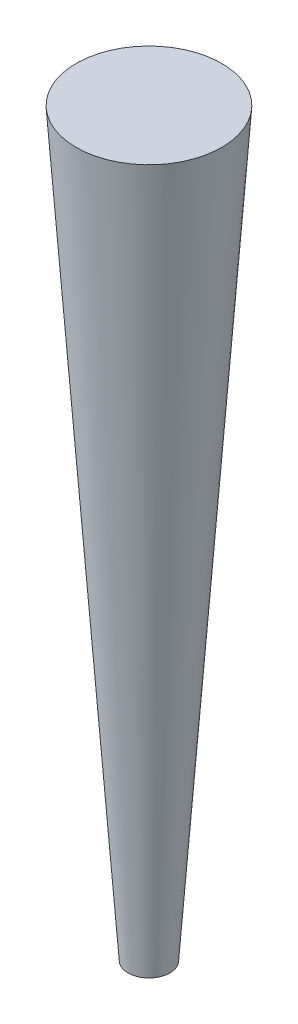
from build123d import *

# Parameters (mm, degrees)
CUT_EXTRUDE1_DEPTH      = 303.786152292
CUT_EXTRUDE1_DEPTH_BACK = 303.786152292
SKETCH2_W               = 29.225395191
SKETCH2_H               = 5


with BuildPart() as part:
    # Sketch1 → Revolve1 (revolve)
    with BuildSketch(Plane.XY, mode=Mode.PRIVATE) as revolve1_sk:
        Polygon((0, 0), (0, 300), (28.978043583, 300), (8, 0), align=None)
    revolve(revolve1_sk.sketch.rotate(Axis((0, 0, 0), (0, 1, 0)), 270), axis=Axis((0, 0, 0), (0, 1, 0)))

    # Sketch2 → Cut-Extrude1 (cut, two sides: drawn at the far end of the back side and taken through both)
    with BuildSketch(Plane.XY.offset(-CUT_EXTRUDE1_DEPTH_BACK)):
        with Locations((-1.753719429, 2.475032054)):
            Rectangle(SKETCH2_W, SKETCH2_H)
    extrude(amount=CUT_EXTRUDE1_DEPTH + CUT_EXTRUDE1_DEPTH_BACK, mode=Mode.SUBTRACT)


solid = part.part
